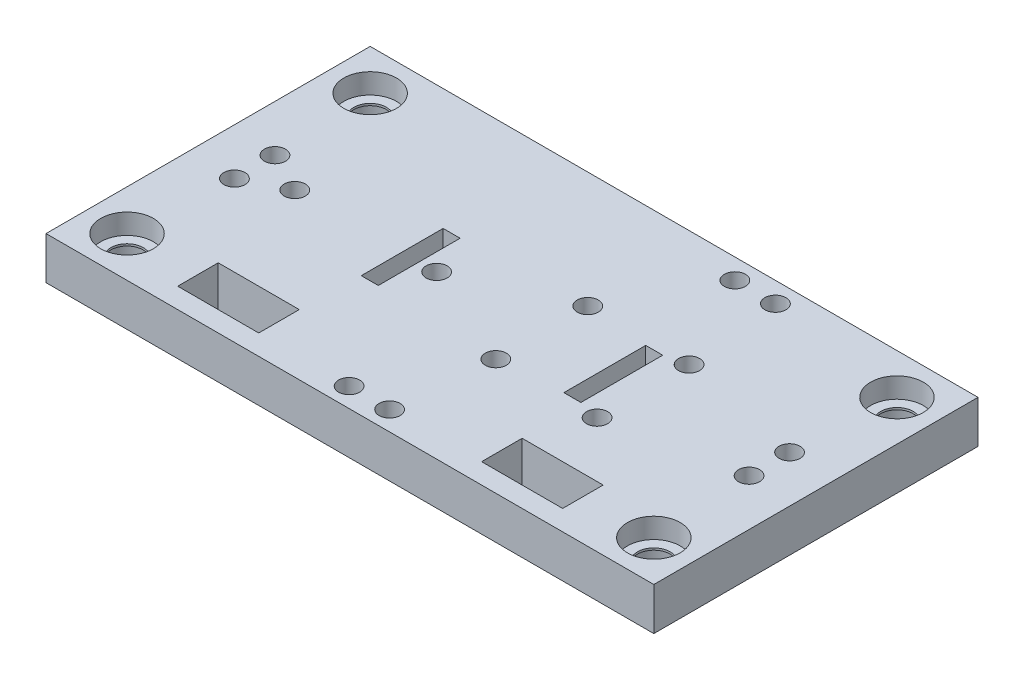
from build123d import *

# Parameters (mm, degrees)
SKETCH1_W            = 150
SKETCH1_H            = 80
BOSS_EXTRUDE1_DEPTH  = 10.5
SKETCH10_R           = 6.5
CUT_EXTRUDE8_DEPTH   = 5
WIREHOLES_REACH      = 172.324
SKETCH3_W            = 20
SKETCH3_H            = 10
SKETCH6_R            = 2.6
F_4AACUT_DEPTH       = 5.2
SKETCH7_R            = 2.6
F_2AACUT_DEPTH       = 5.2
SKETCH5_W            = 4.2
SKETCH5_H            = 20.2
ARDUINOMEGACUT_DEPTH = 5.2
SKETCH8_R            = 2.6
MPUCUT_DEPTH         = 5.2
CUT_EXTRUDE7_REACH   = 172.324
SKETCH9_R            = 2.6
SKETCH11_R           = 4
CUT_EXTRUDE9_DEPTH   = 0.5
SKETCH12_R           = 2.6
CUT_EXTRUDE10_DEPTH  = 5


with BuildPart() as part:
    # Sketch1 → Boss-Extrude1 (new body)
    with BuildSketch(Plane(origin=(0, 0, 0), x_dir=(1, 0, 0), z_dir=(0, 1, 0))):
        with Locations((75, 40)):
            Rectangle(SKETCH1_W, SKETCH1_H)
    extrude(amount=BOSS_EXTRUDE1_DEPTH)

    # Sketch10 → Cut-Extrude8 (cut)
    with BuildSketch(Plane(origin=(0, 10.5, 0), x_dir=(1, 0, 0), z_dir=(0, 1, 0))):
        with Locations(Location((10, 10, 0), (0, 0, 270))):
            Circle(SKETCH10_R)
        with Locations(Location((140, 10, 0), (0, 0, 270))):
            Circle(SKETCH10_R)
        with Locations(Location((10, 70, 0), (0, 0, 270))):
            Circle(SKETCH10_R)
        with Locations(Location((140, 70, 0), (0, 0, 270))):
            Circle(SKETCH10_R)
    cut_extrude8 = extrude(amount=-CUT_EXTRUDE8_DEPTH, mode=Mode.SUBTRACT)

    # Mirror1: Cut-Extrude8 across plane
    add(cut_extrude8.mirror(Plane.ZX.offset(5.25)), mode=Mode.SUBTRACT)

    # Sketch3 → WireHoles (cut, up to next)
    with BuildSketch(Plane(origin=(0, 10.5, 0), x_dir=(1, 0, 0), z_dir=(0, 1, 0)), mode=Mode.PRIVATE) as wireholes_sk1:
        with Locations((37.5, 10)):
            Rectangle(SKETCH3_W, SKETCH3_H)
    wireholes_tool1 = extrude(wireholes_sk1.sketch, amount=-WIREHOLES_REACH, mode=Mode.PRIVATE) & part.part
    # Sketch3 → WireHoles (cut, up to next)
    with BuildSketch(Plane(origin=(0, 10.5, 0), x_dir=(1, 0, 0), z_dir=(0, 1, 0)), mode=Mode.PRIVATE) as wireholes_sk2:
        with Locations((112.5, 10)):
            Rectangle(SKETCH3_W, SKETCH3_H)
    wireholes_tool2 = extrude(wireholes_sk2.sketch, amount=-WIREHOLES_REACH, mode=Mode.PRIVATE) & part.part
    add(wireholes_tool1.solids().sort_by_distance((37.5, 10.5, -10))[0], mode=Mode.SUBTRACT)
    add(wireholes_tool2.solids().sort_by_distance((112.5, 10.5, -10))[0], mode=Mode.SUBTRACT)

    # Sketch6 → 4AACut (cut)
    with BuildSketch(Plane(origin=(0, 10.5, 0), x_dir=(1, 0, 0), z_dir=(0, 1, 0))):
        with Locations(Location((21.4, 40, 0), (0, 0, 270))):
            Circle(SKETCH6_R)
        with Locations(Location((56.4, 40, 0), (0, 0, 90))):
            Circle(SKETCH6_R)
    extrude(amount=-F_4AACUT_DEPTH, mode=Mode.SUBTRACT)

    # Sketch7 → 2AACut (cut)
    with BuildSketch(Plane(origin=(0, 10.5, 0), x_dir=(1, 0, 0), z_dir=(0, 1, 0))):
        with Locations(Location((82.35, 51.35, 0), (0, 0, 270))):
            Circle(SKETCH7_R)
        with Locations(Location((107.35, 51.35, 0), (0, 0, 90))):
            Circle(SKETCH7_R)
        with Locations(Location((82.35, 28.65, 0), (0, 0, 90))):
            Circle(SKETCH7_R)
        with Locations(Location((107.35, 28.65, 0), (0, 0, 270))):
            Circle(SKETCH7_R)
    extrude(amount=-F_2AACUT_DEPTH, mode=Mode.SUBTRACT)

    # Sketch5 → ArduinoMegaCut (cut)
    with BuildSketch(Plane(origin=(0, 10.5, 0), x_dir=(1, 0, 0), z_dir=(0, 1, 0))):
        with Locations((50, 40)):
            Rectangle(SKETCH5_W, SKETCH5_H)
        with Locations((100, 40)):
            Rectangle(SKETCH5_W, SKETCH5_H)
    extrude(amount=-ARDUINOMEGACUT_DEPTH, mode=Mode.SUBTRACT)

    # Sketch8 → MPUCut (cut)
    with BuildSketch(Plane(origin=(0, 10.5, 0), x_dir=(1, 0, 0), z_dir=(0, 1, 0))):
        with Locations(Location((70, 4.8, 0), (0, 0, 270))):
            Circle(SKETCH8_R)
        with Locations(Location((80, 4.8, 0), (0, 0, 90))):
            Circle(SKETCH8_R)
    extrude(amount=-MPUCUT_DEPTH, mode=Mode.SUBTRACT)

    # Sketch9 → Cut-Extrude7 (cut, up to next)
    with BuildSketch(Plane(origin=(0, 10.5, 0), x_dir=(1, 0, 0), z_dir=(0, 1, 0)), mode=Mode.PRIVATE) as cut_extrude7_sk1:
        with Locations(Location((138.5, 45, 0), (0, 0, 270))):
            Circle(SKETCH9_R)
    cut_extrude7_tool1 = extrude(cut_extrude7_sk1.sketch, amount=-CUT_EXTRUDE7_REACH, mode=Mode.PRIVATE) & part.part
    # Sketch9 → Cut-Extrude7 (cut, up to next)
    with BuildSketch(Plane(origin=(0, 10.5, 0), x_dir=(1, 0, 0), z_dir=(0, 1, 0)), mode=Mode.PRIVATE) as cut_extrude7_sk2:
        with Locations(Location((138.5, 35, 0), (0, 0, 270))):
            Circle(SKETCH9_R)
    cut_extrude7_tool2 = extrude(cut_extrude7_sk2.sketch, amount=-CUT_EXTRUDE7_REACH, mode=Mode.PRIVATE) & part.part
    # Sketch9 → Cut-Extrude7 (cut, up to next)
    with BuildSketch(Plane(origin=(0, 10.5, 0), x_dir=(1, 0, 0), z_dir=(0, 1, 0)), mode=Mode.PRIVATE) as cut_extrude7_sk3:
        with Locations(Location((11.5, 45, 0), (0, 0, 270))):
            Circle(SKETCH9_R)
    cut_extrude7_tool3 = extrude(cut_extrude7_sk3.sketch, amount=-CUT_EXTRUDE7_REACH, mode=Mode.PRIVATE) & part.part
    # Sketch9 → Cut-Extrude7 (cut, up to next)
    with BuildSketch(Plane(origin=(0, 10.5, 0), x_dir=(1, 0, 0), z_dir=(0, 1, 0)), mode=Mode.PRIVATE) as cut_extrude7_sk4:
        with Locations(Location((11.5, 35, 0), (0, 0, 270))):
            Circle(SKETCH9_R)
    cut_extrude7_tool4 = extrude(cut_extrude7_sk4.sketch, amount=-CUT_EXTRUDE7_REACH, mode=Mode.PRIVATE) & part.part
    add(cut_extrude7_tool1.solids().sort_by_distance((138.5, 10.5, -45))[0], mode=Mode.SUBTRACT)
    add(cut_extrude7_tool2.solids().sort_by_distance((138.5, 10.5, -35))[0], mode=Mode.SUBTRACT)
    add(cut_extrude7_tool3.solids().sort_by_distance((11.5, 10.5, -45))[0], mode=Mode.SUBTRACT)
    add(cut_extrude7_tool4.solids().sort_by_distance((11.5, 10.5, -35))[0], mode=Mode.SUBTRACT)

    # Sketch11 → Cut-Extrude9 (cut)
    with BuildSketch(Plane(origin=(0, 5.5, 0), x_dir=(1, 0, 0), z_dir=(0, 1, 0))):
        with Locations(Location((10, 10, 0), (0, 0, 270))):
            Circle(SKETCH11_R)
        with Locations(Location((10, 70, 0), (0, 0, 90))):
            Circle(SKETCH11_R)
        with Locations(Location((140, 70, 0), (0, 0, 270))):
            Circle(SKETCH11_R)
        with Locations(Location((140, 10, 0), (0, 0, 90))):
            Circle(SKETCH11_R)
    extrude(amount=-CUT_EXTRUDE9_DEPTH, mode=Mode.SUBTRACT)

    # Sketch12 → Cut-Extrude10 (cut)
    with BuildSketch(Plane(origin=(0, 10.5, 0), x_dir=(1, 0, 0), z_dir=(0, 1, 0))):
        with Locations(Location((95, 75, 0), (0, 0, 270))):
            Circle(SKETCH12_R)
        with Locations(Location((105, 75, 0), (0, 0, 90))):
            Circle(SKETCH12_R)
    extrude(amount=-CUT_EXTRUDE10_DEPTH, mode=Mode.SUBTRACT)


solid = part.part
